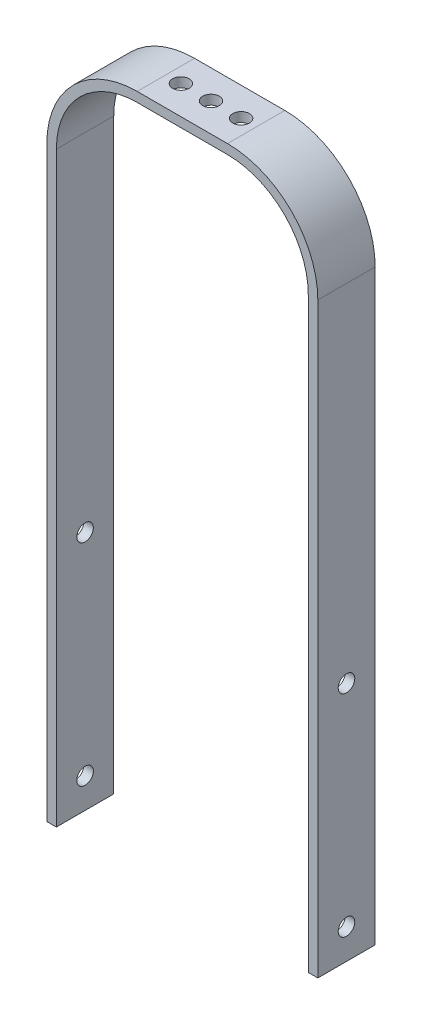
from build123d import *

# Parameters (mm, degrees)
BOSS_EXTRUDE1_DEPTH     = 9.525
SKETCH12_R              = 2.75
CUT_EXTRUDE2_DEPTH      = 230.653490339
CUT_EXTRUDE3_DEPTH      = 285.764333485
CUT_EXTRUDE3_DEPTH_BACK = 285.764333485
SKETCH13_R              = 2.75


with BuildPart() as part:
    # Sketch1 → Boss-Extrude1 (new, symmetric)
    with BuildSketch(Plane.XY):
        with BuildLine():
            Line((45, 45), (45, 240))
            ThreePointArc((45, 240), (36.213203436, 261.213203436), (15, 270))
            Line((15, 270), (-15, 270))
            ThreePointArc((-15, 270), (-36.213203436, 261.213203436), (-45, 240))
            Line((-45, 240), (-45, 45))
            Line((-45, 45), (-41.825, 45))
            Line((-41.825, 45), (-41.825, 240))
            ThreePointArc((-41.825, 240), (-33.968139405, 258.968139405), (-15, 266.825))
            Line((-15, 266.825), (15, 266.825))
            ThreePointArc((15, 266.825), (33.968139405, 258.968139405), (41.825, 240))
            Line((41.825, 240), (41.825, 45))
            Line((41.825, 45), (45, 45))
        make_face()
    extrude(amount=BOSS_EXTRUDE1_DEPTH, both=True)

    # Sketch12 → Cut-Extrude2 (cut, through all)
    with BuildSketch(Plane(origin=(0, 270, 0), x_dir=(1, 0, 0), z_dir=(0, 1, 0))):
        with Locations(Location((0, 0, 0), (0, 0, 270))):
            Circle(SKETCH12_R)
        with Locations(Location((-10, 0, 0), (0, 0, 270))):
            Circle(SKETCH12_R)
        with Locations(Location((10, 0, 0), (0, 0, 270))):
            Circle(SKETCH12_R)
    extrude(amount=-CUT_EXTRUDE2_DEPTH, mode=Mode.SUBTRACT)

    # Sketch13 → Cut-Extrude3 (cut, two sides: drawn at the far end of the back side and taken through both)
    with BuildSketch(Plane(origin=(45, 0, 0), x_dir=(0, 0, -1), z_dir=(1, 0, 0)).offset(-CUT_EXTRUDE3_DEPTH_BACK)):
        with Locations(Location((0, 125, 0), (0, 0, 90))):
            Circle(SKETCH13_R)
        with Locations(Location((0, 55, 0), (0, 0, 90))):
            Circle(SKETCH13_R)
    extrude(amount=CUT_EXTRUDE3_DEPTH + CUT_EXTRUDE3_DEPTH_BACK, mode=Mode.SUBTRACT)


solid = part.part
